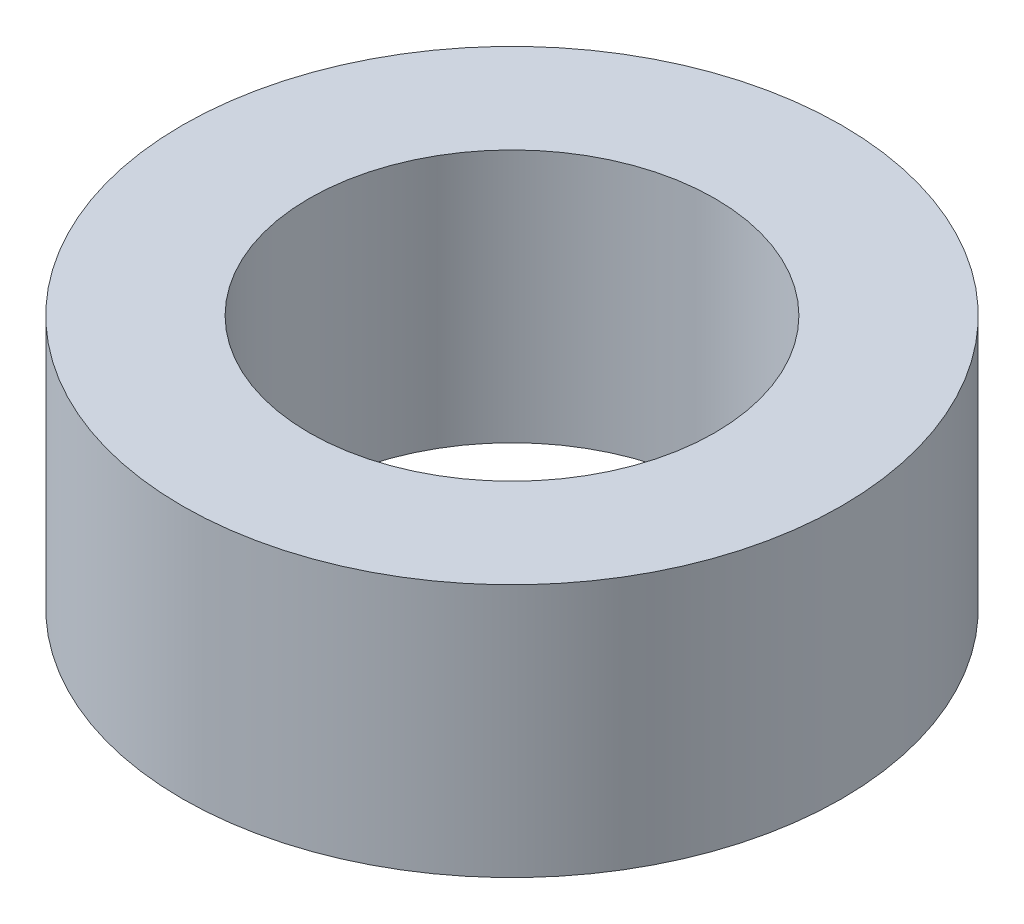
from build123d import *

# Parameters (mm, degrees)
SKETCH1_R           = 6.5
SKETCH1_R_2         = 4
BOSS_EXTRUDE1_DEPTH = 5


with BuildPart() as part:
    # Sketch1 → Boss-Extrude1 (new body)
    with BuildSketch(Plane(origin=(0, 0, 0), x_dir=(1, 0, 0), z_dir=(0, 1, 0))):
        with Locations(Location((0, 0, 0), (0, 0, 270))):
            Circle(SKETCH1_R)
        with Locations(Location((0, 0, 0), (0, 0, 270))):
            Circle(SKETCH1_R_2, mode=Mode.SUBTRACT)
    extrude(amount=BOSS_EXTRUDE1_DEPTH)


solid = part.part
